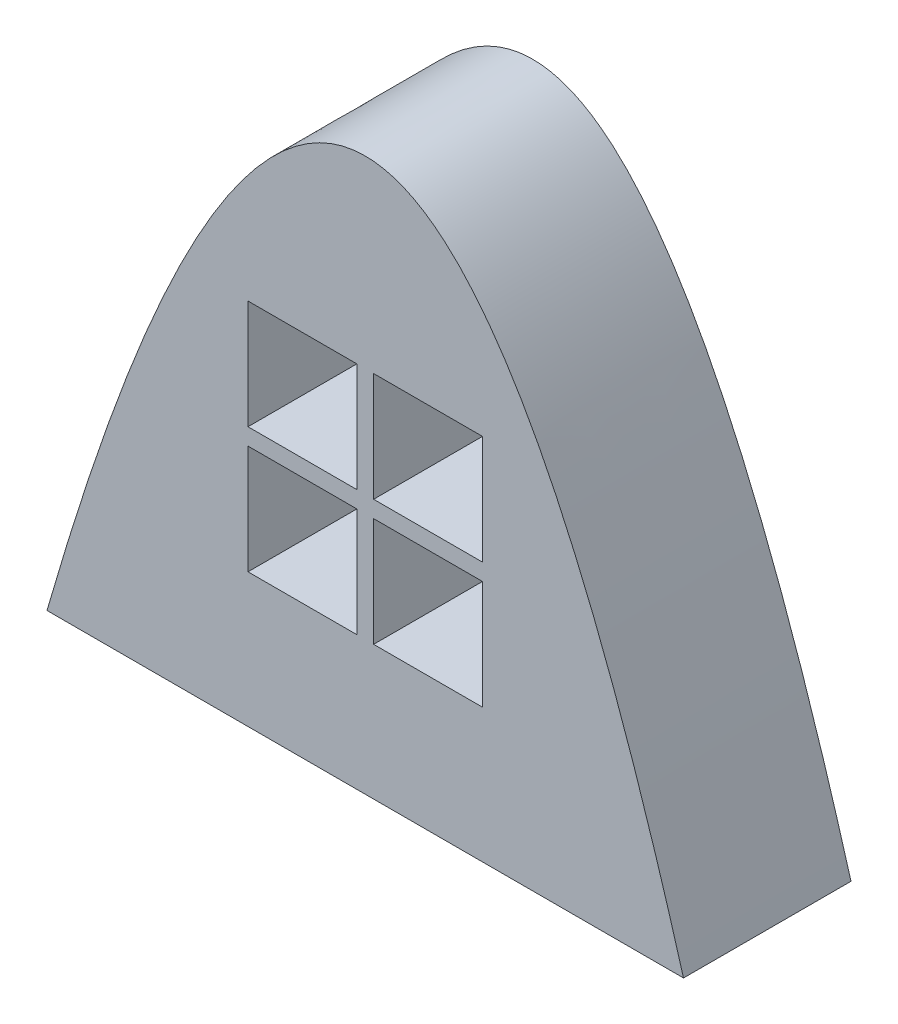
from build123d import *

# Parameters (mm, degrees)
EXTRUDE_1_DEPTH     = 10
SKETCH_2_W          = 6.5
SKETCH_2_H          = 6.5
CUT_EXTRUDE_1_DEPTH = 10


with BuildPart() as part:
    # 草图1 → 凸台-拉伸1 (new body)
    with BuildSketch(Plane.XY):
        with BuildLine():
            add(Edge.make_bspline(
                [(-19, 0), (-9.5, 33), (0, 33)],
                knots=[0, 0, 0, 0.5, 0.5, 0.5], degree=2))
            Line((-19, 0), (0, 0))
            Line((0, 0), (0, 33))
        make_face()
        with BuildLine():
            Line((0, 33), (0, 0))
            Line((0, 0), (19, 0))
            add(Edge.make_bspline(
                [(0, 33), (9.5, 33), (19, 0)],
                knots=[0.5, 0.5, 0.5, 1, 1, 1], degree=2))
        make_face()
    extrude(amount=EXTRUDE_1_DEPTH)

    # 草图2 → 切除-拉伸1 (cut)
    with BuildSketch(Plane(origin=(0, 0, 0), x_dir=(-1, 0, 0), z_dir=(0, 0, -1))):
        with Locations((-3.75, 18.75)):
            Rectangle(SKETCH_2_W, SKETCH_2_H)
        with Locations((-3.75, 11.25)):
            Rectangle(SKETCH_2_W, SKETCH_2_H)
        with Locations((3.75, 11.25)):
            Rectangle(SKETCH_2_W, SKETCH_2_H)
        with Locations((3.75, 18.75)):
            Rectangle(SKETCH_2_W, SKETCH_2_H)
    extrude(amount=-CUT_EXTRUDE_1_DEPTH, mode=Mode.SUBTRACT)


solid = part.part
